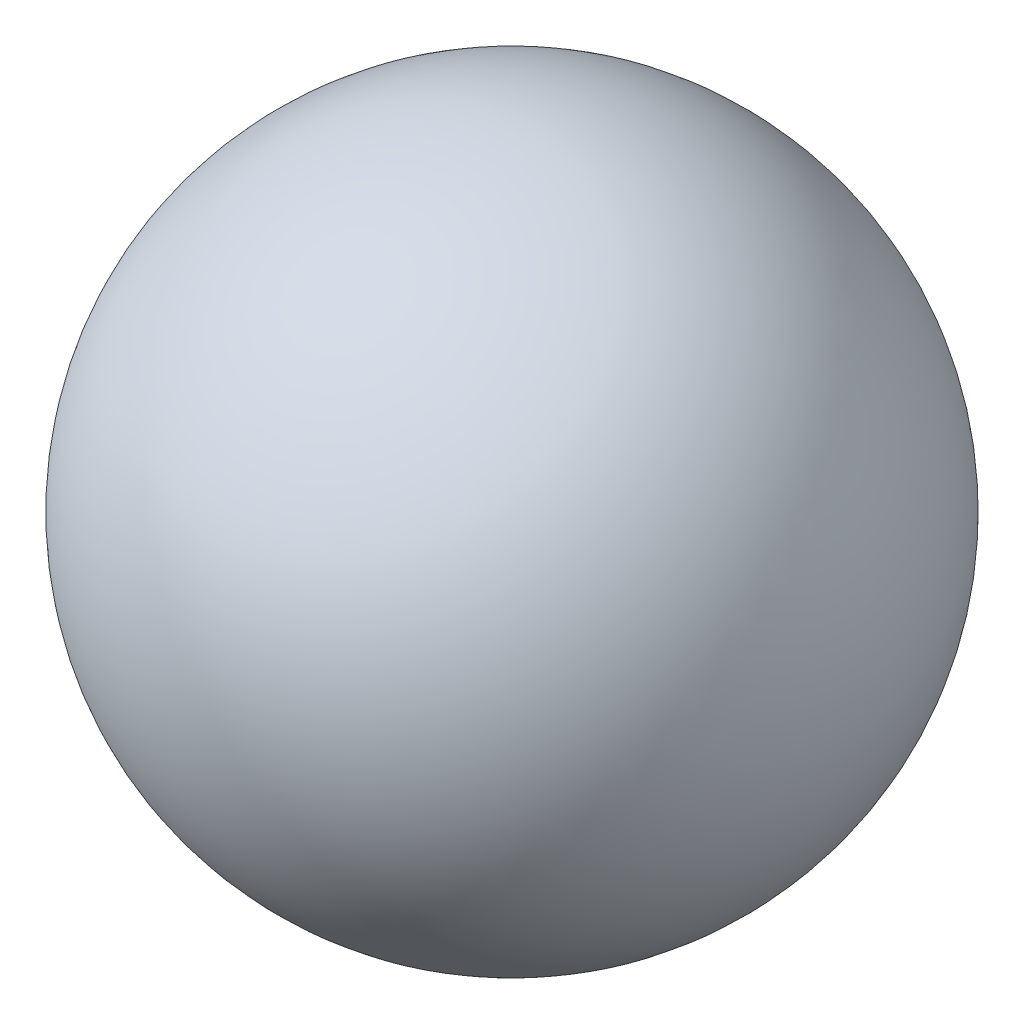
from build123d import *


with BuildPart() as part:
    # Croquis1 → Revolución1 (revolve)
    with BuildSketch(Plane(origin=(0, 0, 0), x_dir=(0, 0, -1), z_dir=(1, 0, 0))):
        with BuildLine():
            Line((0, 88.9), (0, -88.9))
            ThreePointArc((0, -88.9), (-88.9, 0), (0, 88.9))
        make_face()
    revolve(axis=Axis((0, 88.9, 0), (0, -1, 0)))


solid = part.part
